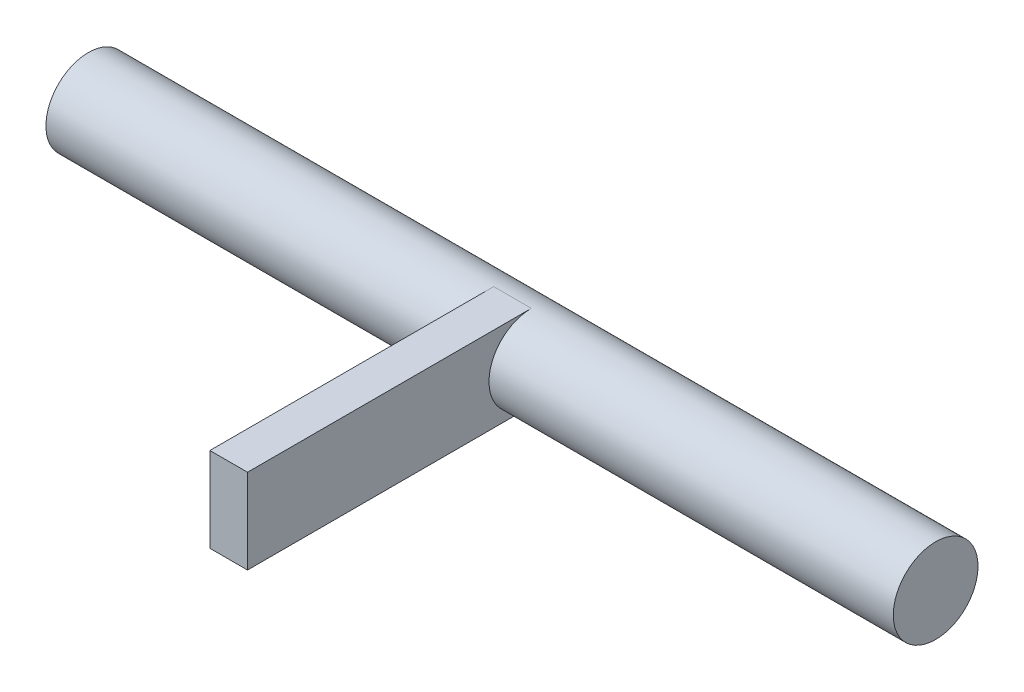
from build123d import *

# Parameters (mm, degrees)
SKETCH_1_R      = 10
EXTRUDE_1_DEPTH = 200
SKETCH_4_W      = 8.886532998
SKETCH_4_H      = 20
EXTRUDE_2_DEPTH = 67


with BuildPart() as part:
    # 草图1 → 凸台-拉伸1 (new body)
    with BuildSketch(Plane(origin=(0, 0, 0), x_dir=(0, 0, -1), z_dir=(1, 0, 0))):
        Circle(SKETCH_1_R)
    extrude(amount=EXTRUDE_1_DEPTH)

    # 草图4 → 凸台-拉伸2 (add)
    with BuildSketch(Plane.XY):
        with Locations((100.138852078, 0)):
            Rectangle(SKETCH_4_W, SKETCH_4_H)
    extrude(amount=EXTRUDE_2_DEPTH)


solid = part.part
